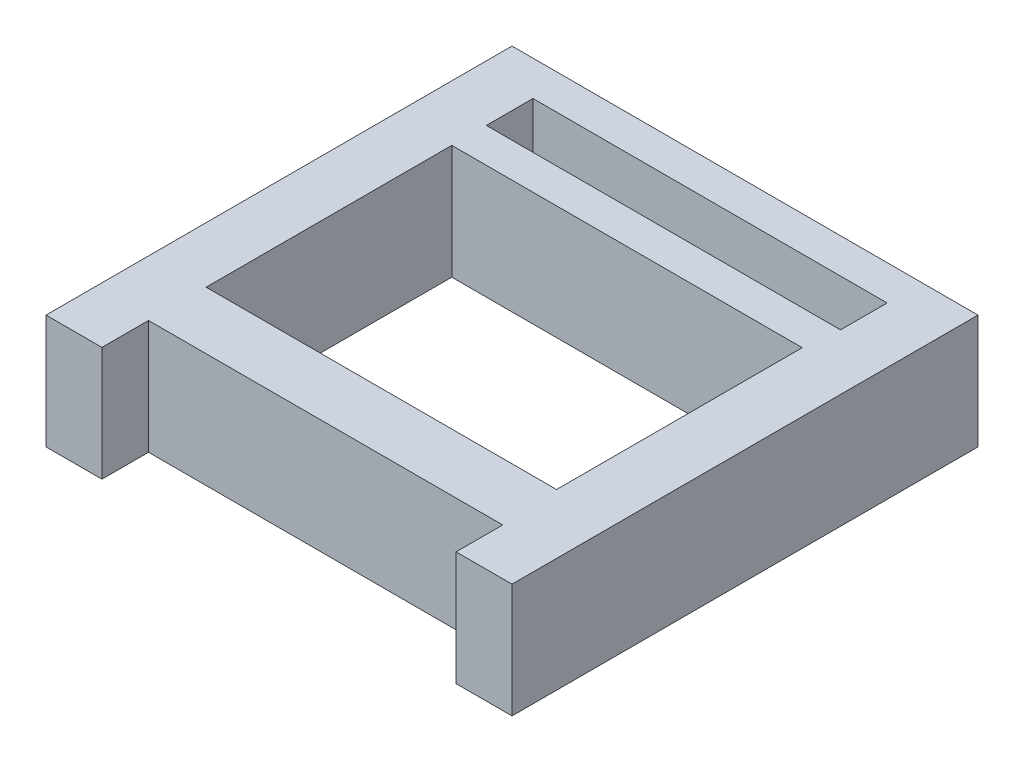
from build123d import *

# Parameters (mm, degrees)
SKETCH1_W           = 15.039204539
SKETCH1_H           = 10.543027195
SKETCH1_W_2         = 15.2
SKETCH1_H_2         = 2
BOSS_EXTRUDE1_DEPTH = 4.9


with BuildPart() as part:
    # Sketch1 → Boss-Extrude1 (new body)
    with BuildSketch(Plane(origin=(0, 0, 0), x_dir=(1, 0, 0), z_dir=(0, 1, 0))):
        Polygon((2.4, 0), (17.6, 0), (17.6, -2), (20, -2), (20, 0), (20, 18), (0, 18), (0, 0), (0, -2), (2.4, -2), align=None)
        with Locations((9.91960227, 7.744546306)):
            Rectangle(SKETCH1_W, SKETCH1_H, mode=Mode.SUBTRACT)
        with Locations((10, 15.5)):
            Rectangle(SKETCH1_W_2, SKETCH1_H_2, mode=Mode.SUBTRACT)
    extrude(amount=BOSS_EXTRUDE1_DEPTH)


solid = part.part
